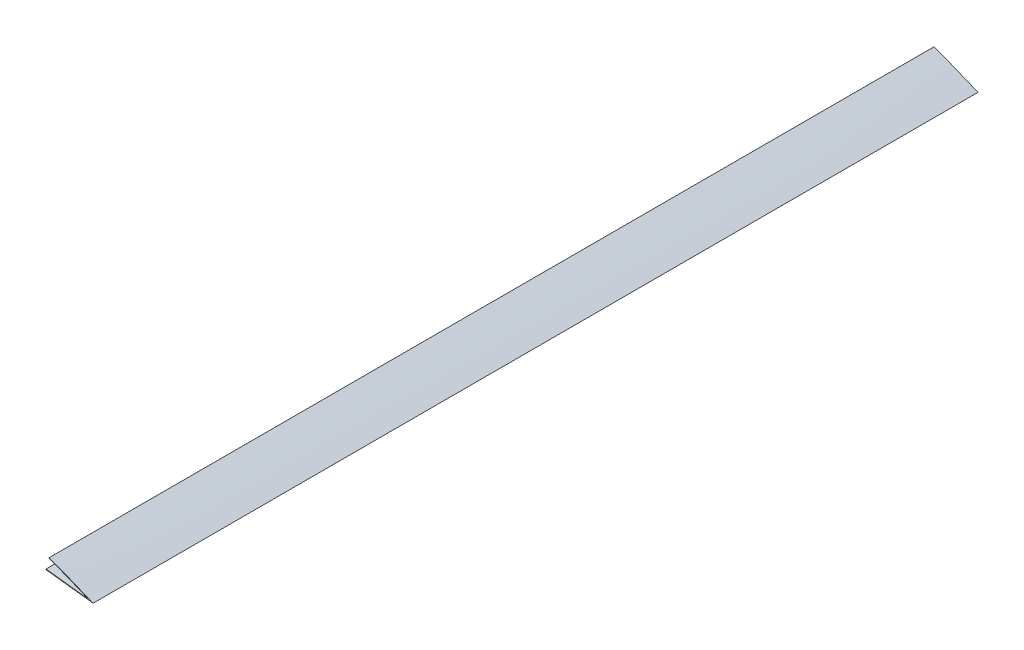
from build123d import *

# Parameters (mm, degrees)
BOSS_EXTRUDE1_DEPTH = 720.725


with BuildPart() as part:
    # Sketch2 → Boss-Extrude1 (new body)
    with BuildSketch(Plane.XY):
        with BuildLine():
            Line((1990.421486693, 2953.497553429), (1990.598028741, 2953.970958412))
            add(Edge.make_bspline(
                [(2026.378123223, 2939.726019749), (2025.772367033, 2939.966817705), (2025.167001193, 2940.208065776), (2024.563270161, 2940.45119895), (2024.252449888, 2940.576371776), (2023.942062924, 2940.702044254), (2023.632279085, 2940.828412198), (2019.922907303, 2942.341550154), (2016.300010508, 2943.954402829), (2008.840382128, 2946.884862912), (2005.182046354, 2948.446003317), (1998.49830219, 2950.992561795), (1995.575349012, 2952.143708473), (1991.935867823, 2953.473628662), (1991.266522782, 2953.72164072), (1990.598028741, 2953.970958412)],
                knots=[0.099020879, 0.099020879, 0.099020879, 0.099020879, 0.175577174, 0.175577174, 0.175577174, 0.214990832, 0.214990832, 0.214990832, 0.686932531, 0.686932531, 1.158874229, 1.158874229, 1.531655023, 1.531655023, 1.615895701, 1.615895701, 1.615895701, 1.615895701], degree=3))
            add(Edge.make_bspline(
                [(1988.02305883, 2944.185998102), (1988.486093696, 2944.140440591), (1990.118619768, 2943.977588834), (1992.878565386, 2943.651927789), (1996.260561822, 2943.27824299), (1999.50276369, 2942.881360992), (2002.595054506, 2942.588170362), (2005.514279258, 2942.198699316), (2008.286301016, 2941.928612986), (2010.885526485, 2941.569057415), (2013.333900984, 2941.299836639), (2015.607898689, 2941.033281035), (2017.705847242, 2940.755050343), (2019.629402987, 2940.578518098), (2021.367662073, 2940.314827517), (2022.931203684, 2940.147471412), (2024.319748194, 2939.977883581), (2025.440549175, 2939.811318081), (2026.113682533, 2939.755557142), (2026.378123223, 2939.726019749)],
                knots=[28.432980691, 28.432980691, 28.432980691, 28.432980691, 28.487933475, 28.626756368, 28.761203264, 28.889815923, 29.012534113, 29.128021866, 29.237609431, 29.341433808, 29.437893302, 29.528519208, 29.611854391, 29.687830524, 29.756590169, 29.81943804, 29.873536901, 29.921805305, 29.953240386, 29.953240386, 29.953240386, 29.953240386], degree=3))
            Line((1988.02305883, 2944.185998102), (1988.074605977, 2944.709910093))
            add(Edge.make_bspline(
                [(1988.074605977, 2944.709910093), (1989.230150517, 2944.58289678), (1990.385621975, 2944.45341125), (1998.052162808, 2943.575786345), (2004.595655519, 2942.866835827), (2014.99093127, 2941.587524984), (2018.884584402, 2941.067615831), (2022.866460843, 2940.614570977)],
                knots=[28.432746502, 28.432746502, 28.432746502, 28.432746502, 28.569989508, 28.569989508, 29.343340852, 29.343340852, 29.81381441, 29.81381441, 29.81381441, 29.81381441], degree=3))
            add(Edge.make_bspline(
                [(2022.866460843, 2940.614570977), (2021.798028907, 2941.061512065), (2020.716308213, 2941.506999086), (2015.217323697, 2943.787839229), (2010.802115728, 2945.575588777), (2001.866334932, 2949.196830335), (1997.44616335, 2950.892375156), (1992.11061417, 2952.870832924), (1991.266086469, 2953.18432728), (1990.421486693, 2953.497553429)],
                knots=[0.240373092, 0.240373092, 0.240373092, 0.240373092, 0.376824745, 0.376824745, 0.94322841, 0.94322841, 1.509632074, 1.509632074, 1.616176715, 1.616176715, 1.616176715, 1.616176715], degree=3))
        make_face()
    extrude(amount=BOSS_EXTRUDE1_DEPTH)


solid = part.part
